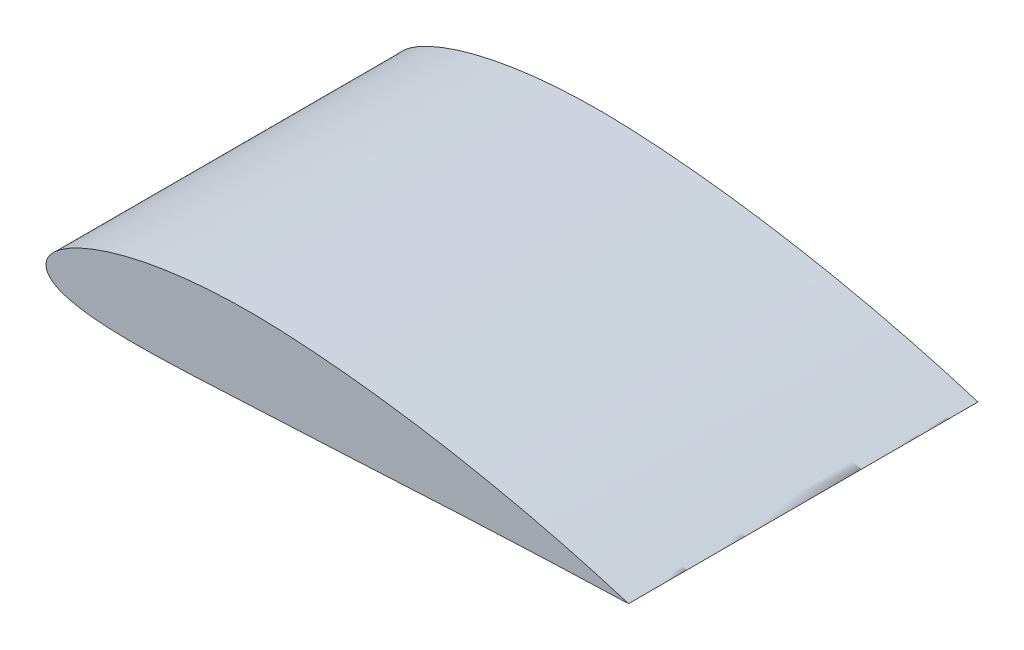
from build123d import *

# Parameters (mm, degrees)
BOSS_EXTRUDE1_DEPTH = 90


with BuildPart() as part:
    # Sketch1 → Boss-Extrude1 (new body)
    with BuildSketch(Plane(origin=(0, 0, 0), x_dir=(0, 1, 0), z_dir=(0, 0, 1))):
        with BuildLine():
            add(Edge.make_bspline(
                [(0, -150), (0.00207689, -150.000272104), (0.020842626, -149.921973552), (0.050484701, -149.842519038), (0.108295906, -149.64531571), (0.184870335, -149.399874005), (0.284434689, -149.072414173), (0.405292386, -148.677343737), (0.546896463, -148.209483066), (0.709511433, -147.671383631), (0.892173176, -147.062641824), (1.094210492, -146.384048917), (1.315445779, -145.636148319), (1.555064972, -144.819611323), (1.812215783, -143.93505163), (2.086183965, -142.983296263), (2.376127223, -141.965168506), (2.681510407, -140.881543016), (3.001098946, -139.733311673), (3.334435691, -138.521573964), (3.679677875, -137.247259696), (4.037295757, -135.911779029), (4.404712081, -134.515919657), (4.782313473, -133.061288331), (5.168006103, -131.548973046), (5.561547504, -129.980544735), (5.961411328, -128.357257086), (6.366936773, -126.68066884), (6.776686753, -124.952285557), (7.189826452, -123.173710005), (7.605332144, -121.346696761), (8.022029638, -119.472806813), (8.439065258, -117.55394469), (8.855208058, -115.591819418), (9.269267927, -113.588294478), (9.680889473, -111.545360235), (10.088180209, -109.464827039), (10.490864842, -107.348799554), (10.887686494, -105.199373578), (11.277318394, -103.018484494), (11.659564897, -100.808431903), (12.032522441, -98.5711341), (12.396104732, -96.308995921), (12.748946619, -94.024131008), (13.090332599, -91.718883117), (13.418934501, -89.395427569), (13.73474532, -87.056288794), (14.036164335, -84.703605233), (14.322638769, -82.339824935), (14.593270833, -79.96732541), (14.847821133, -77.588565412), (15.084623694, -75.205889779), (15.304104302, -72.82176977), (15.504585241, -70.438652223), (15.685944977, -68.058989128), (15.847767707, -65.685284449), (15.989037685, -63.319955851), (16.110220485, -60.956986882), (16.20952967, -58.592759211), (16.275154655, -56.229329964), (16.310032197, -53.878077895), (16.312426537, -51.547507167), (16.283274791, -49.240331581), (16.222189185, -46.959152522), (16.129781894, -44.706622513), (16.006687137, -42.485365174), (15.85250731, -40.297945153), (15.668973306, -38.146881082), (15.45603527, -36.034630368), (15.214701797, -33.963718149), (14.945606464, -31.936438624), (14.650431122, -29.95508522), (14.329328289, -28.021999538), (13.9841488, -26.139303664), (13.615608086, -24.309089704), (13.225299824, -22.533391018), (12.814339799, -20.814157065), (12.384367351, -19.153262545), (11.936368831, -17.552531403), (11.472378934, -16.013545319), (10.993397845, -14.537965829), (10.501415698, -13.127179537), (9.99758517, -11.782668697), (9.483830168, -10.505636059), (8.96091466, -9.297579011), (8.431452195, -8.159122252), (7.895949806, -7.0916723), (7.35643566, -6.095909395), (6.814047818, -5.172799624), (6.270498773, -4.322796162), (5.726515685, -3.546820922), (5.183735874, -2.845107234), (4.643016838, -2.218271529), (4.105520516, -1.666423195), (3.571751807, -1.190234425), (3.042990468, -0.789296728), (2.519366804, -0.464285947), (2.001376202, -0.21527888), (1.489325793, -0.042861338), (0.983851334, 0.053058027), (0.485498463, 0.071245031), (-0.002448357, 0.012359227), (-0.475516589, -0.120911741), (-0.928469081, -0.328830226), (-1.358883187, -0.609334298), (-1.766640585, -0.961345567), (-2.151638775, -1.384094965), (-2.515030214, -1.875907463), (-2.85634815, -2.436669548), (-3.17677196, -3.064977124), (-3.475756561, -3.760565324), (-3.754066368, -4.522314004), (-4.011910588, -5.349420751), (-4.249101762, -6.240953593), (-4.46648601, -7.195691427), (-4.663653658, -8.212695725), (-4.841353286, -9.290686695), (-4.999725557, -10.428589974), (-5.139374408, -11.625137639), (-5.260112032, -12.879160593), (-5.363186787, -14.189185912), (-5.448208026, -15.553950887), (-5.516348753, -16.972109476), (-5.56780596, -18.442295031), (-5.603213991, -19.963103914), (-5.623501621, -21.533088152), (-5.628743438, -23.150806172), (-5.620408429, -24.814806333), (-5.598840595, -26.523544598), (-5.564743968, -28.275616073), (-5.519460385, -30.069485805), (-5.463220949, -31.903689059), (-5.397297121, -33.776635352), (-5.322720764, -35.686779015), (-5.24034727, -37.632567889), (-5.151083254, -39.612400866), (-5.055901459, -41.624674523), (-4.956255981, -43.667762051), (-4.852524292, -45.740031437), (-4.746274905, -47.839813936), (-4.638056942, -49.965432617), (-4.529416506, -52.115115626), (-4.420933786, -54.28714006), (-4.314022068, -56.47972862), (-4.208491413, -58.696990871), (-4.107698708, -60.945654883), (-4.002236599, -63.223248604), (-3.89137688, -65.521632111), (-3.776751968, -67.830172994), (-3.658794915, -70.146661469), (-3.538147453, -72.468999603), (-3.415416501, -74.794988032), (-3.291154743, -77.122424362), (-3.166079805, -79.449067781), (-3.040406553, -81.772697655), (-2.915241838, -84.091149561), (-2.790422922, -86.402140444), (-2.666442195, -88.70347544), (-2.544127564, -90.992877504), (-2.423326687, -93.268117073), (-2.304668493, -95.526961833), (-2.188522255, -97.767217606), (-2.074577557, -99.986655583), (-1.963689891, -102.183061875), (-1.85548181, -104.35425464), (-1.750545322, -106.498058518), (-1.648749659, -108.612361754), (-1.550003568, -110.695005572), (-1.454802319, -112.743858693), (-1.36306323, -114.756814454), (-1.274598041, -116.731816593), (-1.189369909, -118.666913818), (-1.10770755, -120.560070381), (-1.029256077, -122.409370826), (-0.954136035, -124.212822591), (-0.882324845, -125.968576681), (-0.813706732, -127.67478226), (-0.747897389, -129.329624352), (-0.685679096, -130.931437587), (-0.626047057, -132.478432692), (-0.569602131, -133.968988769), (-0.515822721, -135.401534107), (-0.465242148, -136.774542374), (-0.41723304, -138.086542098), (-0.371958079, -139.336043074), (-0.329351466, -140.521692906), (-0.289517314, -141.64224706), (-0.252142888, -142.696444474), (-0.217469938, -143.683143639), (-0.185655737, -144.601252194), (-0.155977194, -145.44974316), (-0.129275624, -146.227705394), (-0.104721156, -146.934186609), (-0.083015957, -147.568527129), (-0.063885073, -148.129765476), (-0.04702485, -148.617909889), (-0.03286186, -149.030589152), (-0.021648794, -149.372579095), (-0.011784285, -149.629433268), (-0.007321396, -149.834846904), (5.4771e-05, -149.919239994), (-0.002077348, -149.999727836), (0, -150)],
                knots=[0, 0, 0, 0, 0.000122423, 0.000490298, 0.001102555, 0.001958444, 0.003057823, 0.004399158, 0.005980814, 0.007801865, 0.009859754, 0.012152999, 0.014678402, 0.017434489, 0.020417662, 0.023624929, 0.027053311, 0.030698899, 0.034559068, 0.038628862, 0.042904491, 0.047381405, 0.052056062, 0.05692287, 0.061977044, 0.067213831, 0.072627665, 0.078213704, 0.083966421, 0.089879008, 0.095947145, 0.102163478, 0.108522776, 0.115018201, 0.121643513, 0.128392213, 0.13525791, 0.142233186, 0.149311888, 0.156485889, 0.163749344, 0.171094575, 0.178514336, 0.186001163, 0.19354818, 0.201147024, 0.208791074, 0.216471957, 0.224182976, 0.231916011, 0.239663021, 0.247417293, 0.255170457, 0.262915395, 0.270643749, 0.278348637, 0.286022174, 0.29365658, 0.301327823, 0.30900334, 0.316618403, 0.324165152, 0.331637235, 0.339026873, 0.346327256, 0.353531576, 0.360632141, 0.3676235, 0.374497928, 0.381249571, 0.387871562, 0.394358819, 0.400704069, 0.406902137, 0.41294753, 0.418835051, 0.424558548, 0.430114239, 0.43549648, 0.440701256, 0.44572438, 0.450562341, 0.455210912, 0.45966778, 0.463929585, 0.467994131, 0.471860162, 0.475526302, 0.478991292, 0.482256231, 0.485322521, 0.488191948, 0.490868561, 0.493358157, 0.495668335, 0.497809262, 0.499794957, 0.501643842, 0.503378774, 0.505027615, 0.506623311, 0.508202658, 0.509781786, 0.511377441, 0.513024346, 0.514754903, 0.516594987, 0.518566256, 0.520684836, 0.522963485, 0.525410584, 0.528033541, 0.530836486, 0.533821919, 0.536991086, 0.540344426, 0.543881488, 0.547600641, 0.551501292, 0.555580421, 0.55983537, 0.564263041, 0.568860256, 0.573624065, 0.578549925, 0.58363413, 0.58887284, 0.594261147, 0.599795015, 0.605469358, 0.611280457, 0.617222619, 0.62329152, 0.629481809, 0.635788116, 0.642206008, 0.648729551, 0.655353249, 0.662072147, 0.668880722, 0.675772523, 0.682742989, 0.689785186, 0.696893614, 0.704062808, 0.711343695, 0.718754658, 0.726206592, 0.733691639, 0.741202927, 0.748733577, 0.756276706, 0.763824456, 0.771369937, 0.778905799, 0.786424637, 0.793919637, 0.801382962, 0.808807719, 0.816186124, 0.823511315, 0.830775968, 0.837972811, 0.845094984, 0.852134732, 0.859085704, 0.86594063, 0.872692725, 0.879335156, 0.885860652, 0.892262933, 0.898535698, 0.904672621, 0.910666452, 0.91651234, 0.922203013, 0.92773267, 0.933096481, 0.938287617, 0.943301284, 0.948132126, 0.952774341, 0.957224029, 0.96147589, 0.96552507, 0.969367203, 0.972998407, 0.976414817, 0.979612048, 0.98258719, 0.985336878, 0.987857681, 0.990147208, 0.992202512, 0.994021669, 0.995602269, 0.996942823, 0.998041892, 0.998898019, 0.999509749, 0.99987755, 1, 1, 1, 1], degree=3))
        make_face()
    extrude(amount=BOSS_EXTRUDE1_DEPTH)


solid = part.part
